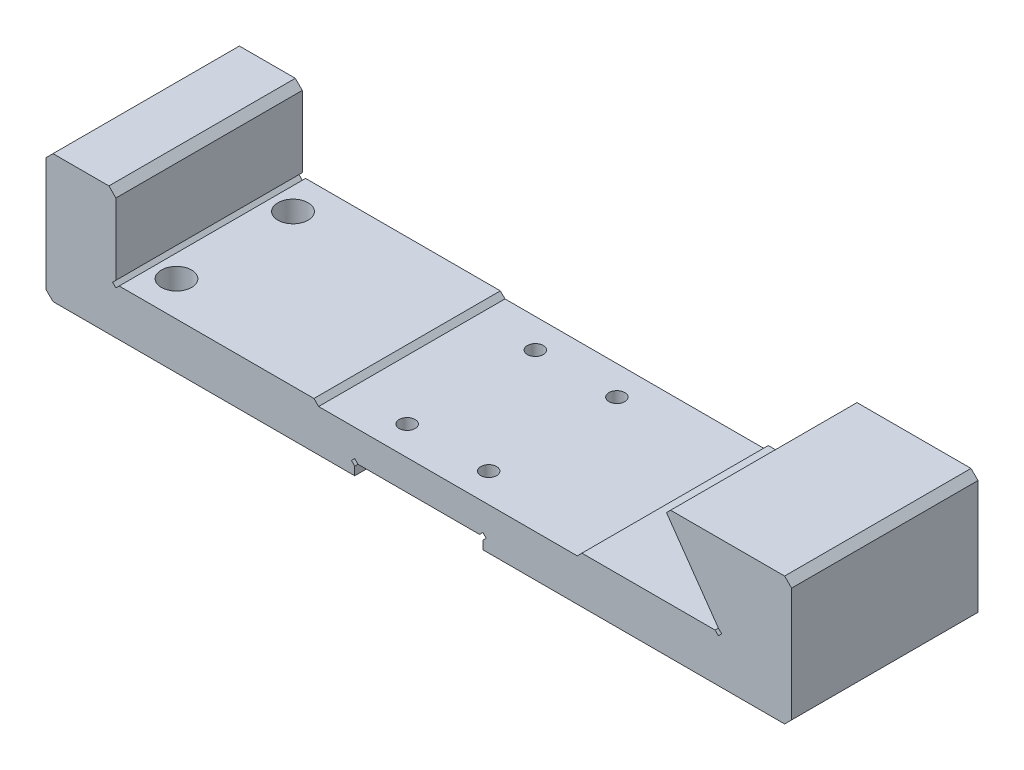
from build123d import *
from OCP.BRepFilletAPI import BRepFilletAPI_MakeChamfer

# Parameters (mm, degrees)
EXTRUDE_1_DEPTH        = 40
SKETCH_2_R             = 6.5
CUT_EXTRUDE_1_DEPTH    = 80
CHAMFER_1_SIZE         = 3
CHAMFER_1_SIZE2        = 2.154045129
HOLE_WIZARD_M8_1_D     = 6.8
HOLE_WIZARD_M8_1_DEPTH = 17.707073895
HOLE_WIZARD_M8_1_TIP   = 2.042926105


with BuildPart() as part:
    # 草图1 → 凸台-拉伸1 (new, symmetric)
    with BuildSketch(Plane.XY):
        Polygon((0, 0), (-43, 0), (-45, 2), (-128.585786438, 2), (-130, 0.585786438), (-131.414213562, 2), (-130, 3.414213562), (-130, 37), (-160, 37), (-160, -18), (-27.5, -18), (-27.5, -14.414213562), (-28.914213562, -13), (-27.5, -11.585786438), (-26.085786438, -13), (26.085786438, -13), (27.5, -11.585786438), (28.914213562, -13), (27.5, -14.414213562), (27.5, -18), (160, -18), (160, 37), (105.068765597, 37), (128.585786438, 3.414213562), (130, 2), (128.585786438, 0.585786438), (127.171572875, 2), (70, 2), (68, 0), align=None)
    extrude(amount=EXTRUDE_1_DEPTH, both=True)

    # 草图2 → 切除-拉伸1 (cut)
    with BuildSketch(Plane(origin=(0, 2, 0), x_dir=(1, 0, 0), z_dir=(0, 1, 0))):
        with Locations(Location((-119, 25, 0), (0, 0, 180))):
            Circle(SKETCH_2_R)
        with Locations(Location((-119, -25, 0), (0, 0, 180))):
            Circle(SKETCH_2_R)
    extrude(amount=-CUT_EXTRUDE_1_DEPTH, mode=Mode.SUBTRACT)

    # 倒角1: one chamfer whose edges measure the first distance from different faces: ONE call of the kernel's chamfer builder (chamfer() names one face for all edges)
    chamfer_1_edges_1 = [part.edges().sort_by_distance(p)[0] for p in [
        (105.068765597, 37, 0),
    ]]
    chamfer_1_side_1 = [part.faces().sort_by_distance(p)[0] for p in [
        (132.534382799, 37, 0),
    ]]
    chamfer_1_edges_2 = [part.edges().sort_by_distance(p)[0] for p in [
        (160, 37, 0),
        (160, -18, 0),
        (-160, -18, 0),
        (-160, 37, 0),
        (-130, 37, 0),
    ]]
    chamfer_1 = BRepFilletAPI_MakeChamfer(part.part.solid().wrapped)
    for e in chamfer_1_edges_1:
        chamfer_1.Add(CHAMFER_1_SIZE, CHAMFER_1_SIZE2, e.wrapped, chamfer_1_side_1[0].wrapped)  # the first distance lies on this face
    for e in chamfer_1_edges_2:
        chamfer_1.Add(CHAMFER_1_SIZE, e.wrapped)
    add(Compound.cast(chamfer_1.Shape()), mode=Mode.REPLACE)

    # M8 螺纹孔1
    with Locations(Plane(origin=(-17.5, 0, -27.5), x_dir=(1, 0, 0), z_dir=(0, 1, 0))):
        with Locations((0, 0), (35, 0), (35, -55), (0, -55)):
            Hole(HOLE_WIZARD_M8_1_D / 2, depth=HOLE_WIZARD_M8_1_DEPTH)
            with Locations((0, 0, -(HOLE_WIZARD_M8_1_DEPTH + HOLE_WIZARD_M8_1_TIP / 2))):  # 118° drill point
                Cone(0, HOLE_WIZARD_M8_1_D / 2, HOLE_WIZARD_M8_1_TIP, mode=Mode.SUBTRACT)


solid = part.part
